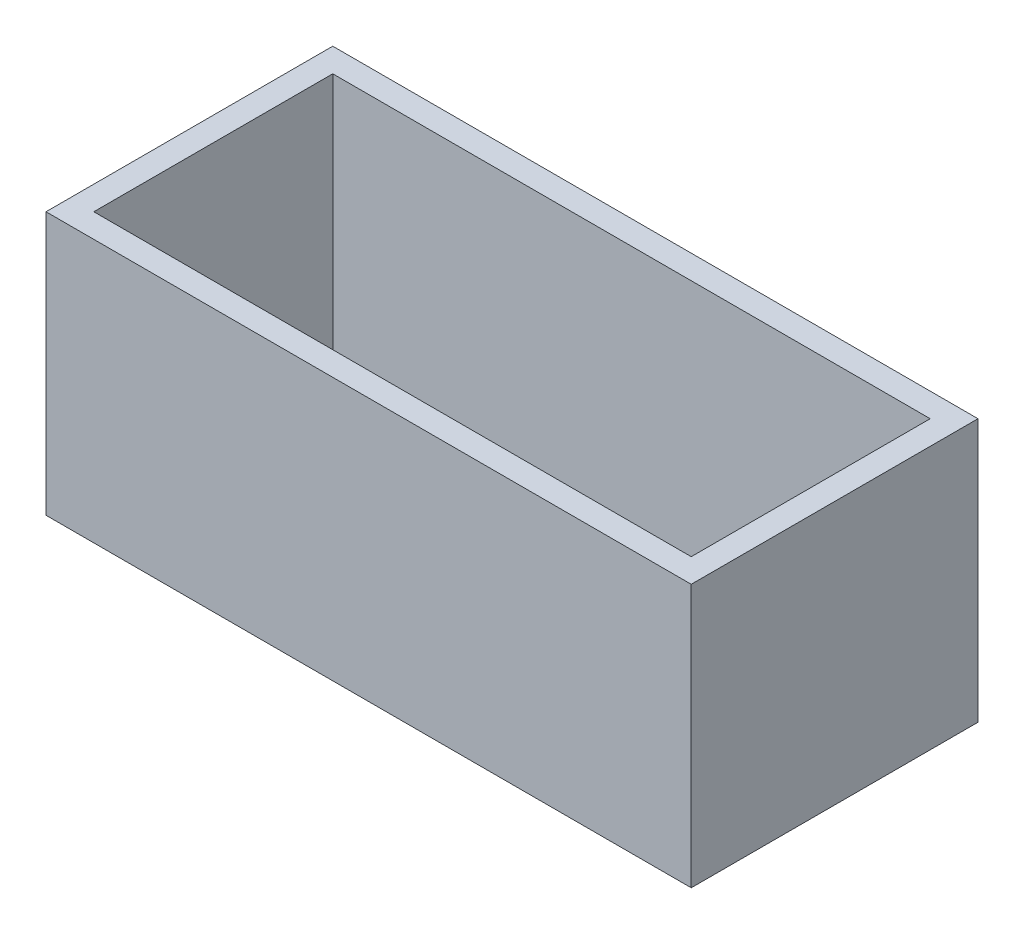
from build123d import *

# Parameters (mm, degrees)
SKETCH8_W           = 135
SKETCH8_H           = 60
SKETCH8_W_2         = 125
SKETCH8_H_2         = 50
BOSS_EXTRUDE1_DEPTH = 25
SKETCH9_W           = 60
SKETCH9_H           = 5
BOSS_EXTRUDE2_DEPTH = 135


with BuildPart() as part:
    # Sketch8 → Boss-Extrude1 (new, symmetric)
    with BuildSketch(Plane(origin=(0, 0, 0), x_dir=(1, 0, 0), z_dir=(0, 1, 0))):
        Rectangle(SKETCH8_W, SKETCH8_H)
        Rectangle(SKETCH8_W_2, SKETCH8_H_2, mode=Mode.SUBTRACT)
    extrude(amount=BOSS_EXTRUDE1_DEPTH, both=True)

    # Sketch9 → Boss-Extrude2 (add)
    with BuildSketch(Plane.ZY.offset(67.5)):
        with Locations((0, -27.5)):
            Rectangle(SKETCH9_W, SKETCH9_H)
    extrude(amount=-BOSS_EXTRUDE2_DEPTH)


solid = part.part
